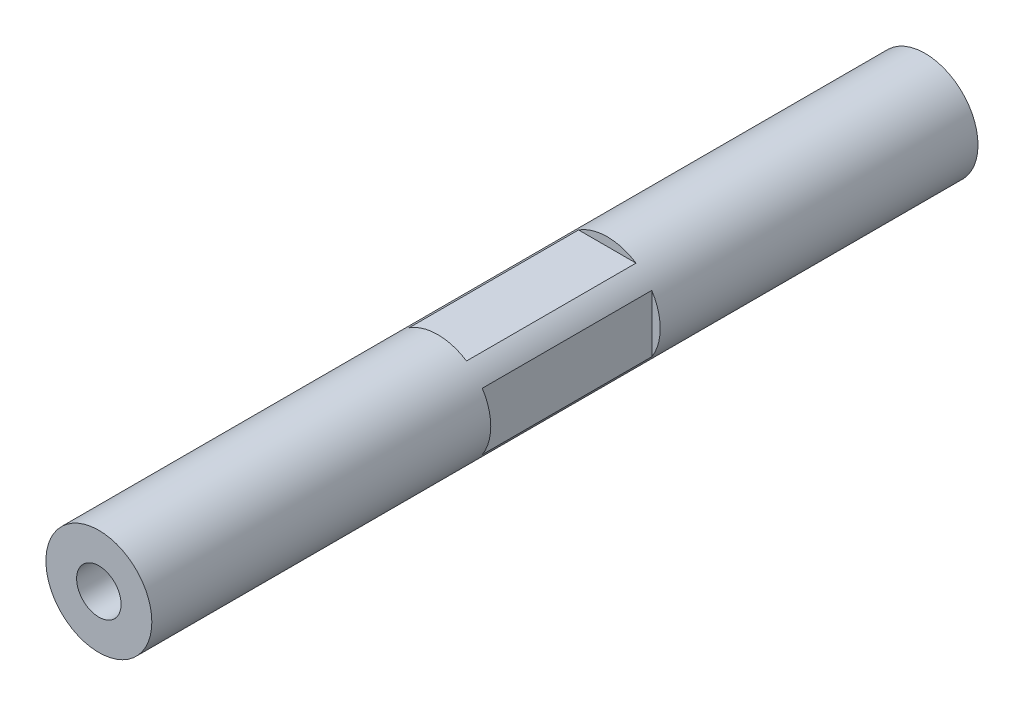
from build123d import *

# Parameters (mm, degrees)
SKETCH_1_R               = 5
EXTRUDE_1_DEPTH          = 78
HOLE_WIZARD_M5_1_D       = 4.2
HOLE_WIZARD_M5_1_DEPTH   = 12.4
HOLE_WIZARD_M5_1_TIP     = 1.2618073
HOLE_WIZARD_M5_2_D       = 4.2
HOLE_WIZARD_M5_2_DEPTH   = 12.4
HOLE_WIZARD_M5_2_TIP     = 1.2618073
CUT_EXTRUDE_1_DEPTH      = 8
CUT_EXTRUDE_1_DEPTH_BACK = 8
SKETCH_6_W               = 7.505950336
SKETCH_6_H               = 7.971260953
SKETCH_6_W_2             = 6.842029893
SKETCH_6_H_2             = 4.427384225
SKETCH_6_W_3             = 6.476020113
SKETCH_6_H_3             = 7.384230107
SKETCH_6_W_4             = 6.951681063
SKETCH_6_H_4             = 4.627406651


with BuildPart() as part:
    # 草图1 → 凸台-拉伸1 (new body)
    with BuildSketch(Plane.XY):
        Circle(SKETCH_1_R)
    extrude(amount=EXTRUDE_1_DEPTH)

    # M5 螺纹孔1
    with Locations(Plane.XY.offset(78)):
        with Locations((0, 0)):
            Hole(HOLE_WIZARD_M5_1_D / 2, depth=HOLE_WIZARD_M5_1_DEPTH)
            with Locations((0, 0, -(HOLE_WIZARD_M5_1_DEPTH + HOLE_WIZARD_M5_1_TIP / 2))):  # 118° drill point
                Cone(0, HOLE_WIZARD_M5_1_D / 2, HOLE_WIZARD_M5_1_TIP, mode=Mode.SUBTRACT)

    # M5 螺纹孔2
    with Locations(Plane(origin=(0, 0, 0), x_dir=(-1, 0, 0), z_dir=(0, 0, -1))):
        with Locations((0, 0)):
            Hole(HOLE_WIZARD_M5_2_D / 2, depth=HOLE_WIZARD_M5_2_DEPTH)
            with Locations((0, 0, -(HOLE_WIZARD_M5_2_DEPTH + HOLE_WIZARD_M5_2_TIP / 2))):  # 118° drill point
                Cone(0, HOLE_WIZARD_M5_2_D / 2, HOLE_WIZARD_M5_2_TIP, mode=Mode.SUBTRACT)

    # 草图6 → 切除-拉伸1 (cut, two sides: drawn at the far end of the back side and taken through both)
    with BuildSketch(Plane.XY.offset(38).offset(-CUT_EXTRUDE_1_DEPTH_BACK)):
        with Locations((-7.952975168, -0.439871177)):
            Rectangle(SKETCH_6_W, SKETCH_6_H)
        with Locations((0.010635023, 6.413692112)):
            Rectangle(SKETCH_6_W_2, SKETCH_6_H_2)
        with Locations((7.438010056, -0.146355753)):
            Rectangle(SKETCH_6_W_3, SKETCH_6_H_3)
        with Locations((-0.075086924, -6.513703325)):
            Rectangle(SKETCH_6_W_4, SKETCH_6_H_4)
    extrude(amount=CUT_EXTRUDE_1_DEPTH + CUT_EXTRUDE_1_DEPTH_BACK, mode=Mode.SUBTRACT)


solid = part.part
